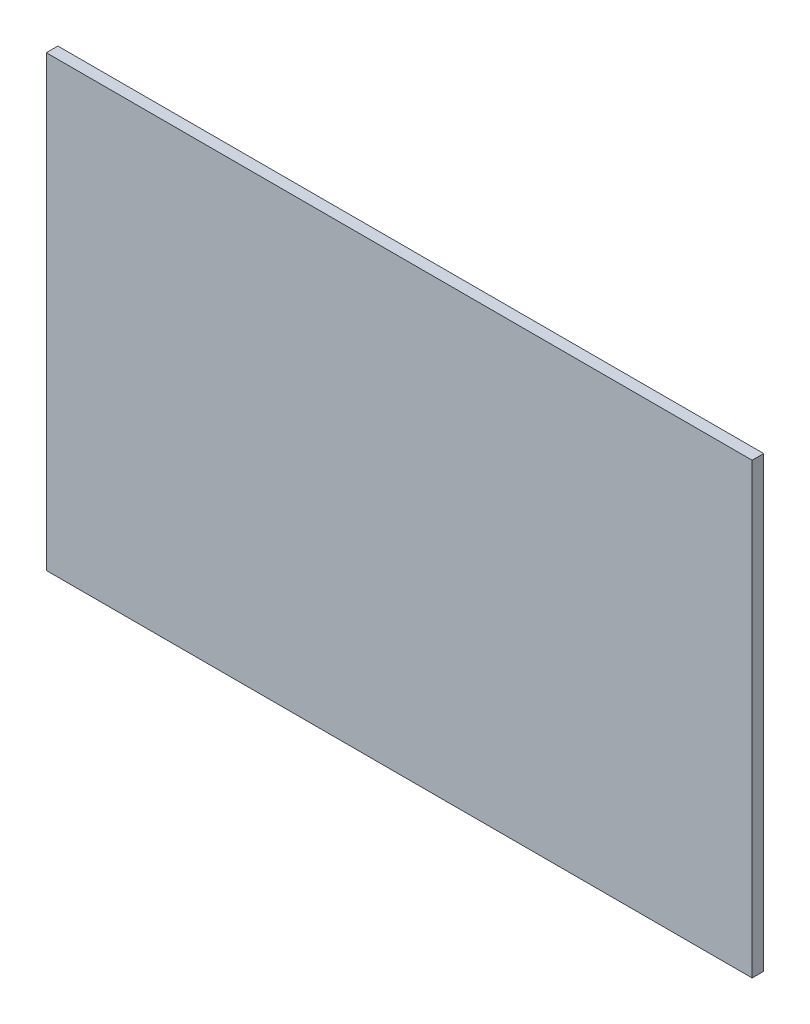
from build123d import *

# Parameters (mm, degrees)
SKETCH1_W           = 2440
SKETCH1_H           = 1550
BOSS_EXTRUDE1_DEPTH = 40


with BuildPart() as part:
    # Sketch1 → Boss-Extrude1 (new body)
    with BuildSketch(Plane.XY):
        with Locations((1220, 775)):
            Rectangle(SKETCH1_W, SKETCH1_H)
    extrude(amount=BOSS_EXTRUDE1_DEPTH)


solid = part.part
